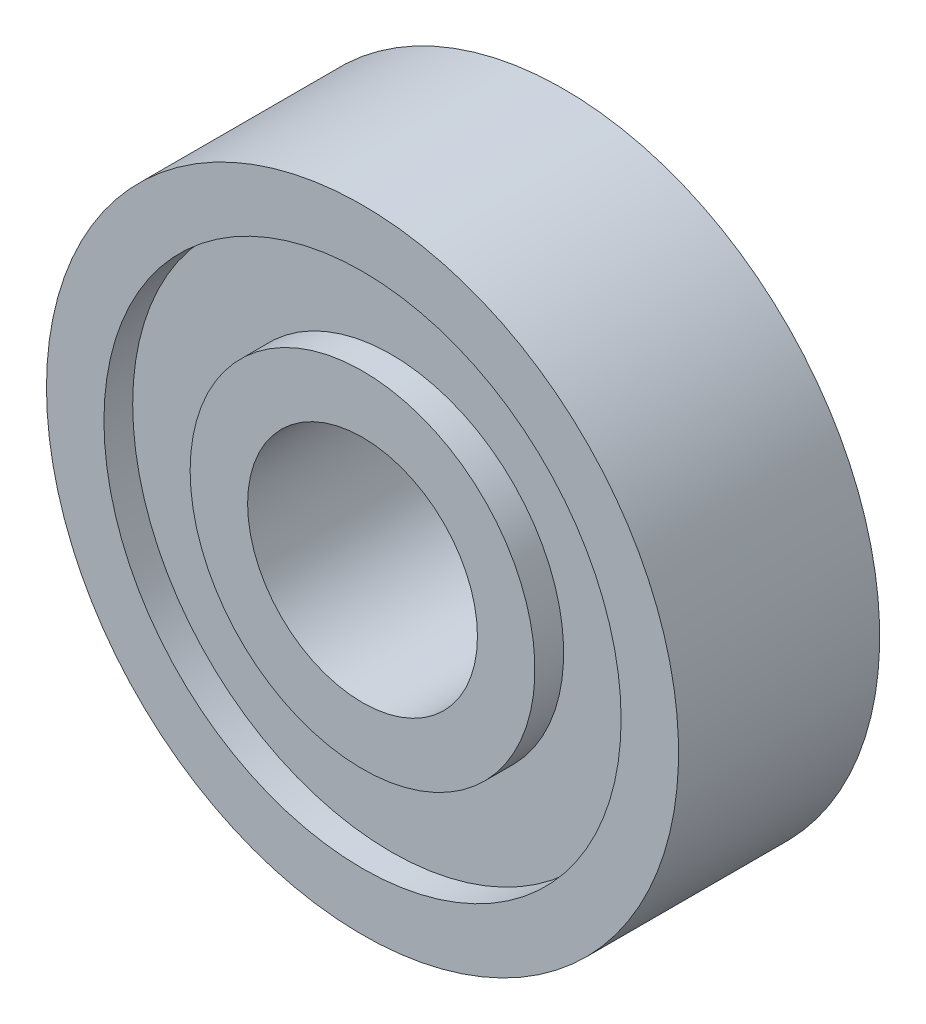
from build123d import *


with BuildPart() as part:
    # Sketch1 → Revolve1 (revolve)
    with BuildSketch(Plane.XZ, mode=Mode.PRIVATE) as revolve1_sk:
        Polygon((6, -3.5), (6, -2.5), (9, -2.5), (9, -3.5), (11, -3.5), (11, 3.5), (9, 3.5), (9, 2.5), (6, 2.5), (6, 3.5), (4, 3.5), (4, -3.5), align=None)
    revolve(revolve1_sk.sketch.rotate(Axis((0, 0, 3.5), (0, 0, -1)), 180), axis=Axis((0, 0, 3.5), (0, 0, -1)))


solid = part.part
